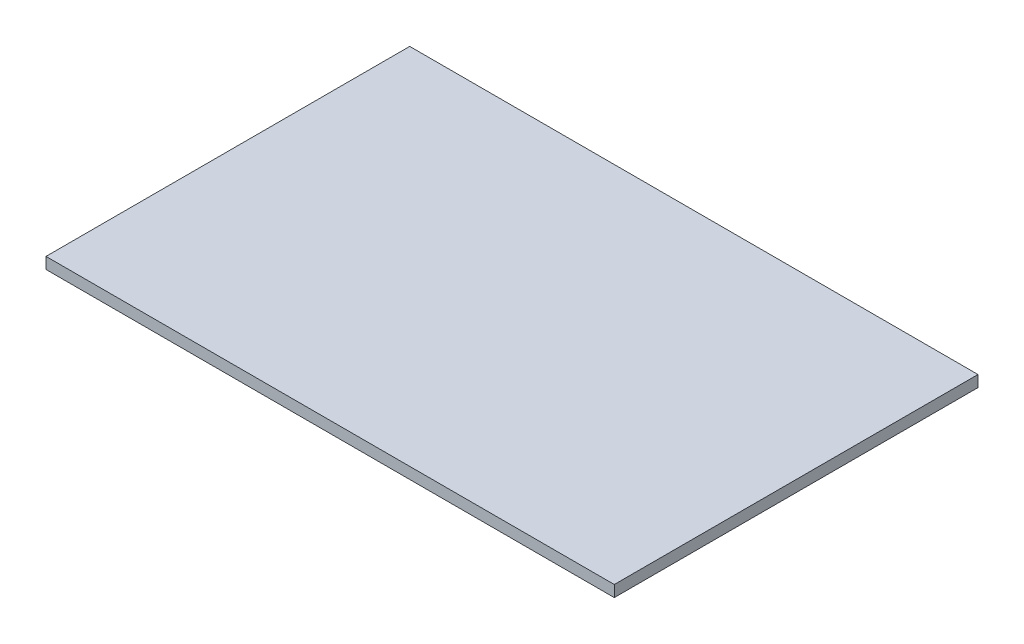
from build123d import *

# Parameters (mm, degrees)
SKETCH_2_W      = 250
SKETCH_2_H      = 160
EXTRUDE_1_DEPTH = 5


with BuildPart() as part:
    # 草图2 → 凸台-拉伸1 (new body)
    with BuildSketch(Plane(origin=(0, 0, 0), x_dir=(1, 0, 0), z_dir=(0, 1, 0))):
        Rectangle(SKETCH_2_W, SKETCH_2_H)
    extrude(amount=EXTRUDE_1_DEPTH)


solid = part.part
